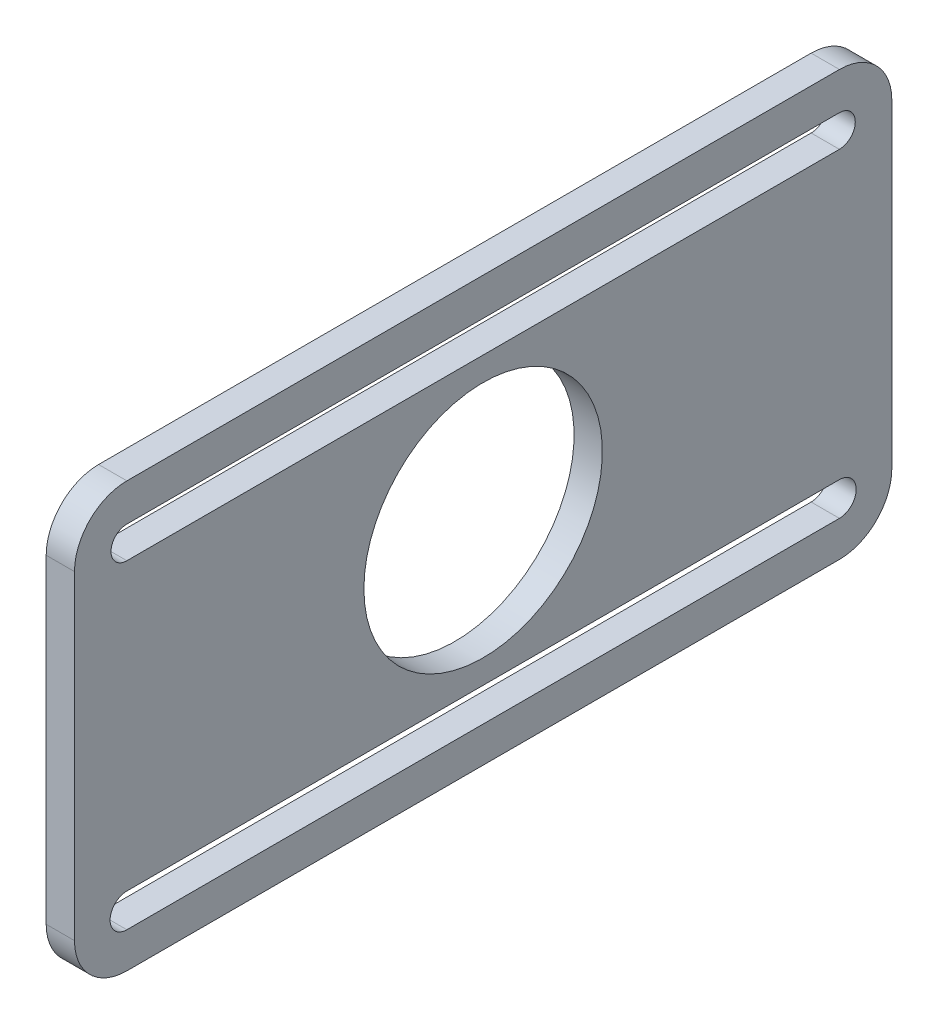
from build123d import *

# Parameters (mm, degrees)
SKETCH_1_R      = 11.380487233
EXTRUDE_1_DEPTH = 2.7


with BuildPart() as part:
    # 草图1 → 凸台-拉伸1 (new body)
    with BuildSketch(Plane(origin=(0, 0, 0), x_dir=(0, 0, -1), z_dir=(1, 0, 0))):
        with BuildLine():
            Line((34, -5.005093632), (-34, -5.005093632))
            ThreePointArc((-34, -5.005093632), (-37.535533906, -3.540627537), (-39, -0.005093632))
            Line((-39, -0.005093632), (-39, 30.494906368))
            ThreePointArc((-39, 30.494906368), (-37.535533906, 34.030440274), (-34, 35.494906368))
            Line((-34, 35.494906368), (34, 35.494906368))
            ThreePointArc((34, 35.494906368), (37.535533906, 34.030440274), (39, 30.494906368))
            Line((39, 30.494906368), (39, -0.005093632))
            ThreePointArc((39, -0.005093632), (37.535533906, -3.540627537), (34, -5.005093632))
        make_face()
        with Locations(Location((0, 15.244906368, 0), (0, 0, 180))):
            Circle(SKETCH_1_R, mode=Mode.SUBTRACT)
        with BuildLine():
            Line((0, 1.594906368), (34, 1.594906368))
            ThreePointArc((34, 1.594906368), (35.6, -0.005093632), (34, -1.605093632))
            Line((34, -1.605093632), (0, -1.605093632))
            Line((0, -1.605093632), (-34, -1.605093632))
            ThreePointArc((-34, -1.605093632), (-35.6, -0.005093632), (-34, 1.594906368))
            Line((-34, 1.594906368), (0, 1.594906368))
        make_face(mode=Mode.SUBTRACT)
        with BuildLine():
            Line((0, 31.922276961), (34, 31.922276961))
            ThreePointArc((34, 31.922276961), (35.513685296, 30.408591665), (34, 28.894906368))
            Line((34, 28.894906368), (0, 28.894906368))
            Line((0, 28.894906368), (-34, 28.894906368))
            ThreePointArc((-34, 28.894906368), (-35.513685296, 30.408591665), (-34, 31.922276961))
            Line((-34, 31.922276961), (0, 31.922276961))
        make_face(mode=Mode.SUBTRACT)
    extrude(amount=EXTRUDE_1_DEPTH)


solid = part.part
